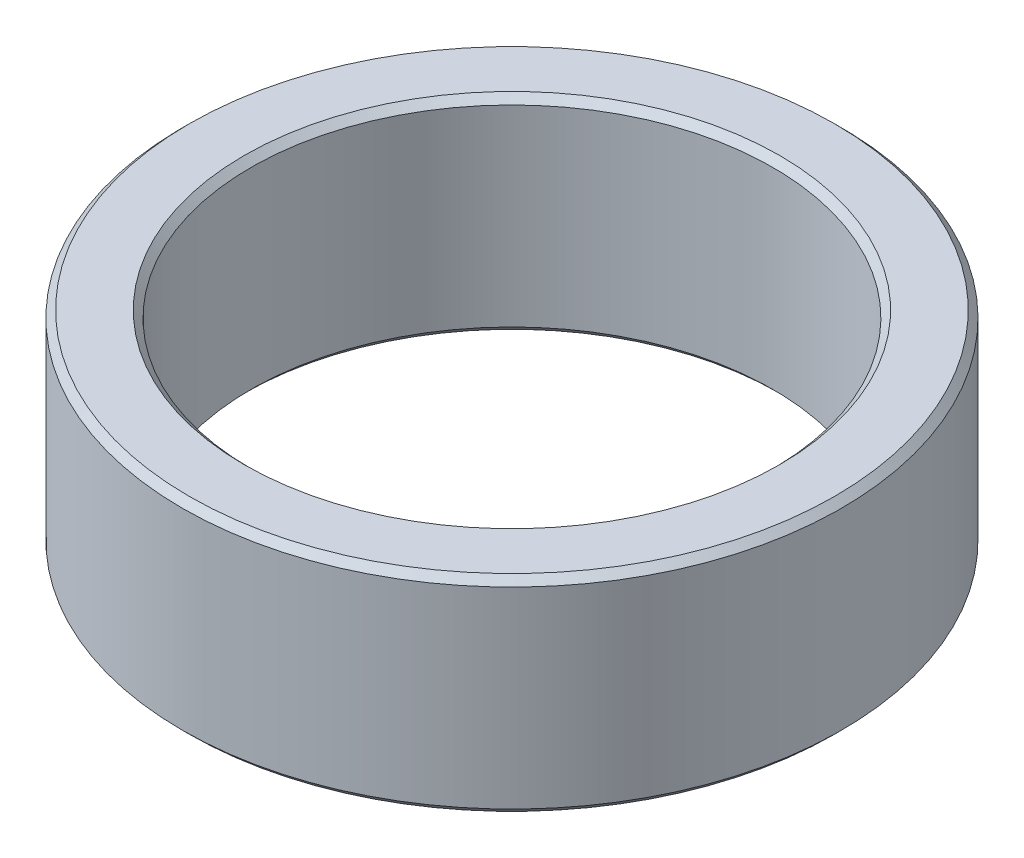
from build123d import *

# Parameters (mm, degrees)
SKETCH1_R           = 24
SKETCH1_R_2         = 19
BOSS_EXTRUDE1_DEPTH = 15
CHAMFER1_SIZE       = 0.5


with BuildPart() as part:
    # Sketch1 → Boss-Extrude1 (new body)
    with BuildSketch(Plane(origin=(0, 0, 0), x_dir=(1, 0, 0), z_dir=(0, 1, 0))):
        with Locations(Location((0, 0, 0), (0, 0, 270))):
            Circle(SKETCH1_R)
        with Locations(Location((0, 0, 0), (0, 0, 270))):
            Circle(SKETCH1_R_2, mode=Mode.SUBTRACT)
    extrude(amount=BOSS_EXTRUDE1_DEPTH)

    # Chamfer1
    chamfer1_edges = [part.edges().sort_by_distance(p)[0] for p in [
        (0, 0, -24),
        (0, 15, -24),
        (0, 0, -19),
        (0, 15, -19),
    ]]
    chamfer(chamfer1_edges, length=CHAMFER1_SIZE)


solid = part.part
